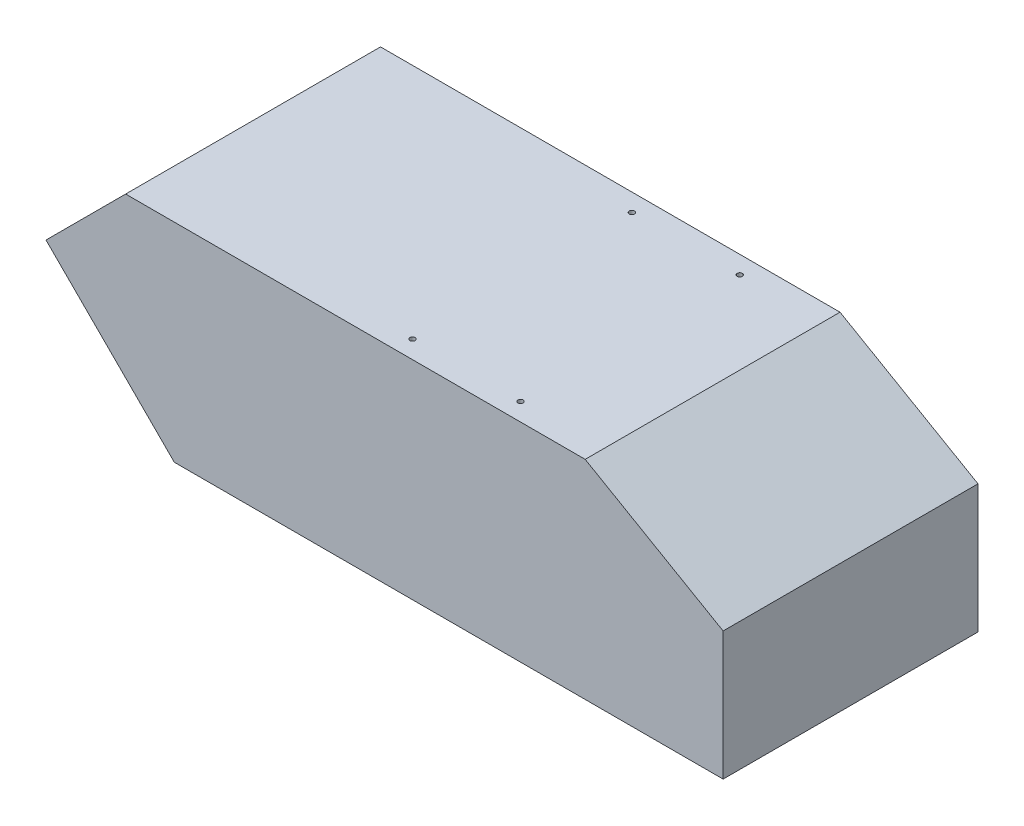
from build123d import *

# Parameters (mm, degrees)
SALIENTE_EXTRUIR2_DEPTH          = 160
TALADRO_DE_MARGEN_PARA_M61_D     = 6.6
TALADRO_DE_MARGEN_PARA_M61_DEPTH = 22
TALADRO_DE_MARGEN_PARA_M61_TIP   = 1.982840043


with BuildPart() as part:
    # Croquis3 → Saliente-Extruir2 (new, symmetric)
    with BuildSketch(Plane.XY):
        Polygon((-344.53, -161.11), (344.53, -161.11), (344.53, 0), (171.324919243, 100), (-405.64, 100), (-505.64, 0), align=None)
    extrude(amount=SALIENTE_EXTRUIR2_DEPTH, both=True)

    # Taladro de margen para M61
    with Locations(Plane(origin=(0, 100, 0), x_dir=(1, 0, 0), z_dir=(0, 1, 0))):
        with Locations((-67.795, 137.645), (67.795, 137.645), (-67.795, -137.645), (67.795, -137.645)):
            Hole(TALADRO_DE_MARGEN_PARA_M61_D / 2, depth=TALADRO_DE_MARGEN_PARA_M61_DEPTH)
            with Locations((0, 0, -(TALADRO_DE_MARGEN_PARA_M61_DEPTH + TALADRO_DE_MARGEN_PARA_M61_TIP / 2))):  # 118° drill point
                Cone(0, TALADRO_DE_MARGEN_PARA_M61_D / 2, TALADRO_DE_MARGEN_PARA_M61_TIP, mode=Mode.SUBTRACT)


solid = part.part
